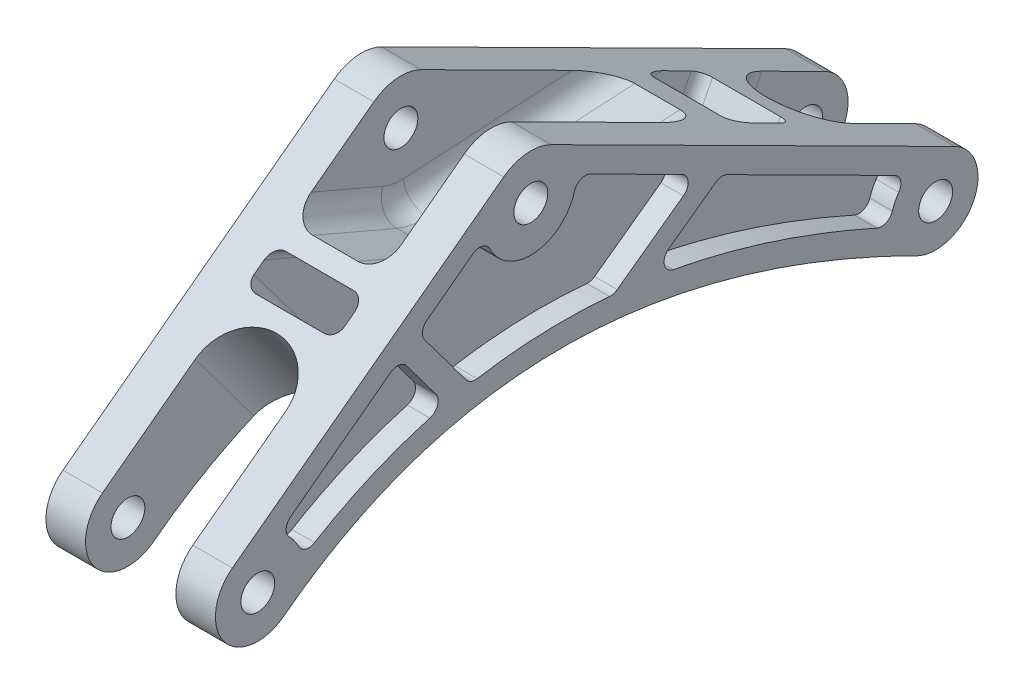
from build123d import *

# Parameters (mm, degrees)
SKETCH_1_R             = 1.5
EXTRUDE_1_DEPTH        = 7.5
CUT_EXTRUDE_1_DEPTH    = 69.394814195
CUT_EXTRUDE_2_DEPTH    = 54.998156761
CUT_EXTRUDE_3_DEPTH    = 4
FILLET_1_R             = 2
CUT_EXTRUDE_4_DEPTH    = 4
FILLET_2_R             = 1
CUT_EXTRUDE_5_DEPTH    = 2
FILLET_3_R             = 1
FILLET_3_OF_MIRROR_1_R = 1


with BuildPart() as part:
    # 草图1 → 凸台-拉伸1 (new, symmetric)
    with BuildSketch(Plane(origin=(0, 0, 0), x_dir=(0, 0, -1), z_dir=(1, 0, 0))):
        with BuildLine():
            Line((-62.247047397, 3.002212184), (-38.23018389, 20.977967169))
            ThreePointArc((-38.23018389, 20.977967169), (-36.184428553, 21.760169232), (-34.033411468, 21.347761097))
            Line((-34.033411468, 21.347761097), (1.687426749, 3.348893992))
            ThreePointArc((1.687426749, 3.348893992), (3.350486015, -1.684263478), (-1.681098704, -3.352075051))
            add(Edge.make_bspline(
                [(-57.720687969, -2.977790567), (-35.833333333, 13.775607506), (-1.681098704, -3.352075051)],
                knots=[0, 0, 0, 1, 1, 1], degree=2))
            ThreePointArc((-57.720687969, -2.977790567), (-62.990044896, -2.263212655), (-62.247047397, 3.002212184))
        make_face()
        Circle(SKETCH_1_R, mode=Mode.SUBTRACT)
        with Locations((-35.833333333, 17.775607506)):
            Circle(SKETCH_1_R, mode=Mode.SUBTRACT)
        with Locations((-60, 0)):
            Circle(SKETCH_1_R, mode=Mode.SUBTRACT)
    extrude(amount=EXTRUDE_1_DEPTH, both=True)

    # 草图3 → 切除-拉伸1 (cut, through all)
    with BuildSketch(Plane(origin=(0, 3.348893992, -1.687426749), x_dir=(1, 0, 0), z_dir=(0, 0.8930383977447939, -0.44998046641316725))):
        with BuildLine():
            Line((4, -6.25), (4, 3.75))
            Line((4, 3.75), (-4, 3.75))
            Line((-4, 3.75), (-4, -6.25))
            ThreePointArc((-4, -6.25), (0, -10.25), (4, -6.25))
        make_face()
    extrude(amount=-CUT_EXTRUDE_1_DEPTH, mode=Mode.SUBTRACT)

    # 草图4 → 切除-拉伸2 (cut, through all)
    with BuildSketch(Plane(origin=(0, 31.78562796, 23.790394616), x_dir=(1, 0, 0), z_dir=(0, 0.8005899156391414, 0.5992126391999025))):
        with BuildLine():
            Line((4, -37.785394938), (4, -51.785394938))
            Line((4, -51.785394938), (-4, -51.785394938))
            Line((-4, -51.785394938), (-4, -37.785394938))
            ThreePointArc((-4, -37.785394938), (0, -33.785394938), (4, -37.785394938))
        make_face()
    extrude(amount=-CUT_EXTRUDE_2_DEPTH, mode=Mode.SUBTRACT)

    # 草图5 → 切除-拉伸3 (cut, symmetric)
    with BuildSketch(Plane(origin=(0, 0, 0), x_dir=(0, 0, -1), z_dir=(1, 0, 0))):
        with BuildLine():
            Line((-35.492385231, 11.785302473), (-17.129799183, 12.830439379))
            Line((-17.129799183, 12.830439379), (-34.033411468, 21.347761097))
            ThreePointArc((-34.033411468, 21.347761097), (-36.184428553, 21.760169232), (-38.23018389, 20.977967169))
            Line((-38.23018389, 20.977967169), (-45.625716743, 15.442677912))
            Line((-45.625716743, 15.442677912), (-38.195682645, 12.260237553))
            ThreePointArc((-38.195682645, 12.260237553), (-36.871556115, 11.866115696), (-35.492385231, 11.785302473))
        make_face()
    extrude(amount=CUT_EXTRUDE_3_DEPTH, both=True, mode=Mode.SUBTRACT)

    # 圆角1
    fillet_1_edges = [part.edges().sort_by_distance(p)[0] for p in [
        (-4, 11.866115696, 36.871556115),
        (-4, 13.851457732, 41.910699694),
        (-4, 12.307870926, 26.311092207),
        (4, 11.866115696, 36.871556115),
        (4, 12.307870926, 26.311092207),
        (4, 13.851457732, 41.910699694),
    ]]
    fillet(fillet_1_edges, radius=FILLET_1_R)

    # 草图6 → 切除-拉伸4 (cut, symmetric)
    with BuildSketch(Plane(origin=(0, 0, 0), x_dir=(0, 0, -1), z_dir=(1, 0, 0))):
        with BuildLine():
            Line((-49.637756226, 12.439811251), (-43.362836441, 4.056080381))
            add(Edge.make_bspline(
                [(-43.362836441, 4.056080381), (-29.866931444, 7.487821817), (-12.961263526, 1.500273987)],
                knots=[0, 0, 0, 1, 1, 1], degree=2))
            Line((-12.961263526, 1.500273987), (-9.252293623, 8.861154705))
            Line((-9.252293623, 8.861154705), (-14.450683989, 11.48049798))
            Line((-14.450683989, 11.48049798), (-17.044562157, 11.332863121))
            Line((-17.044562157, 11.332863121), (-35.407148205, 10.287726215))
            ThreePointArc((-35.407148205, 10.287726215), (-37.131111811, 10.388742744), (-38.786269974, 10.881395064))
            Line((-38.786269974, 10.881395064), (-46.216304071, 14.063835424))
            Line((-46.216304071, 14.063835424), (-47.012379153, 14.404811177))
            Line((-47.012379153, 14.404811177), (-49.637756226, 12.439811251))
        make_face()
    extrude(amount=CUT_EXTRUDE_4_DEPTH, both=True, mode=Mode.SUBTRACT)

    # 圆角2
    fillet_2_edges = [part.edges().sort_by_distance(p)[0] for p in [
        (4, 10.884112098, 24.928916097),
        (4, 10.388742744, 37.131111811),
        (-4, 10.884112098, 24.928916097),
        (-4, 10.388742744, 37.131111811),
        (-4, 5.180714346, 11.106778574),
        (4, 5.180714346, 11.106778574),
        (-4, 8.247945816, 46.500296333),
        (4, 12.64310312, 42.899324563),
        (-4, 12.64310312, 42.899324563),
        (4, 8.247945816, 46.500296333),
    ]]
    fillet(fillet_2_edges, radius=FILLET_2_R)

    # 草图7 → 切除-拉伸5 (cut)
    with BuildSketch(Plane(origin=(7.5, 0, 0), x_dir=(0, 0, -1), z_dir=(1, 0, 0))):
        with BuildLine():
            Line((-20.995530357, 12.538742534), (-31.839796644, 18.002906241))
            ThreePointArc((-31.839796644, 18.002906241), (-35.482238114, 13.791045781), (-39.805083432, 17.301053866))
            Line((-39.805083432, 17.301053866), (-45.832185968, 12.789985282))
            Line((-45.832185968, 12.789985282), (-41.184320735, 6.580112874))
            add(Edge.make_bspline(
                [(-41.184320735, 6.580112874), (-40.052898797, 6.789366889), (-38.914378804, 6.951733026), (-36.496452683, 7.200248901), (-35.215446454, 7.275828786), (-33.281994137, 7.310306481), (-32.634109271, 7.308592715), (-31.343469811, 7.279764167), (-30.700445012, 7.252726084), (-29.535430778, 7.181989), (-29.012718081, 7.142268466), (-28.491382009, 7.094975489)],
                knots=[0.318755002, 0.318755002, 0.318755002, 0.318755002, 0.375, 0.375, 0.4375, 0.4375, 0.46875, 0.46875, 0.5, 0.5, 0.525558574, 0.525558574, 0.525558574, 0.525558574], degree=3))
            Line((-28.491382009, 7.094975489), (-20.995530357, 12.538742534))
        make_face()
        with BuildLine():
            Line((-47.433365799, 11.591560003), (-58.169001353, 3.556324501))
            ThreePointArc((-58.169001353, 3.556324501), (-56.764562129, 2.352008032), (-56.052269551, 0.644534175))
            add(Edge.make_bspline(
                [(-56.052269551, 0.644534175), (-54.883524, 1.4009896), (-53.68318044, 2.098162187), (-51.314548299, 3.318895242), (-49.569587514, 4.118254759), (-47.759423048, 4.795281903), (-46.53785357, 5.218879021), (-45.919801842, 5.416639242), (-44.64984, 5.789823917), (-43.99600998, 5.964228317), (-43.339678361, 6.122107815)],
                knots=[0.057119861, 0.057119861, 0.057119861, 0.057119861, 0.125, 0.125, 0.1875, 0.21875, 0.21875, 0.25, 0.25, 0.282894558, 0.282894558, 0.282894558, 0.282894558], degree=3))
            Line((-43.339678361, 6.122107815), (-47.433365799, 11.591560003))
        make_face()
        with BuildLine():
            Line((-25.563145953, 6.749792544), (-18.986140226, 11.526259409))
            Line((-18.986140226, 11.526259409), (-2.424680458, 3.181340075))
            ThreePointArc((-2.424680458, 3.181340075), (-3.587486622, 1.769163569), (-3.99997878, -0.013029147))
            add(Edge.make_bspline(
                [(-25.563145953, 6.749792544), (-24.525581336, 6.599807891), (-23.493128895, 6.421702508), (-19.963643098, 5.722527528), (-17.489502873, 5.075528885), (-13.81228193, 3.918064275), (-12.591643731, 3.500615297), (-10.176654172, 2.614712319), (-8.9801728, 2.145631241), (-6.518046439, 1.123813823), (-5.253893545, 0.567537447), (-3.99997878, -0.013029147)],
                knots=[0.573643458, 0.573643458, 0.573643458, 0.573643458, 0.625, 0.625, 0.75, 0.75, 0.8125, 0.8125, 0.875, 0.875, 0.942181179, 0.942181179, 0.942181179, 0.942181179], degree=3))
        make_face()
    cut_extrude_5 = extrude(amount=-CUT_EXTRUDE_5_DEPTH, mode=Mode.SUBTRACT)

    # 圆角3
    fillet_3_edges = [part.edges().sort_by_distance(p)[0] for p in [
        (6.5, 17.301053866, 39.805083432),
        (6.5, 12.789985282, 45.832185968),
        (6.5, 6.580112874, 41.184320735),
        (6.5, 7.094975489, 28.491382009),
        (6.5, 12.538742534, 20.995530357),
        (6.5, 18.002906241, 31.839796644),
        (6.5, -0.013029147, 3.99997878),
        (6.5, 3.181340075, 2.424680458),
        (6.5, 11.526259409, 18.986140226),
        (6.5, 6.749792544, 25.563145953),
        (6.5, 3.556324501, 58.169001353),
        (6.5, 0.644534175, 56.052269551),
        (6.5, 6.122107815, 43.339678361),
        (6.5, 11.591560003, 47.433365799),
    ]]
    fillet(fillet_3_edges, radius=FILLET_3_R)

    # 镜向1: 切除-拉伸5 across plane
    add(cut_extrude_5.mirror(Plane(origin=(0, 0, 0), x_dir=(0, 0, 1), z_dir=(1, 0, 0))), mode=Mode.SUBTRACT)

    # 圆角3 of 镜向1
    fillet_3_of_mirror_1_edges = [part.edges().sort_by_distance(p)[0] for p in [
        (-6.5, 17.301053866, 39.805083432),
        (-6.5, 12.789985282, 45.832185968),
        (-6.5, 6.580112874, 41.184320735),
        (-6.5, 7.094975489, 28.491382009),
        (-6.5, 12.538742534, 20.995530357),
        (-6.5, 18.002906241, 31.839796644),
        (-6.5, -0.013029147, 3.99997878),
        (-6.5, 3.181340075, 2.424680458),
        (-6.5, 11.526259409, 18.986140226),
        (-6.5, 6.749792544, 25.563145953),
        (-6.5, 3.556324501, 58.169001353),
        (-6.5, 0.644534175, 56.052269551),
        (-6.5, 6.122107815, 43.339678361),
        (-6.5, 11.591560003, 47.433365799),
    ]]
    fillet(fillet_3_of_mirror_1_edges, radius=FILLET_3_OF_MIRROR_1_R)


solid = part.part
